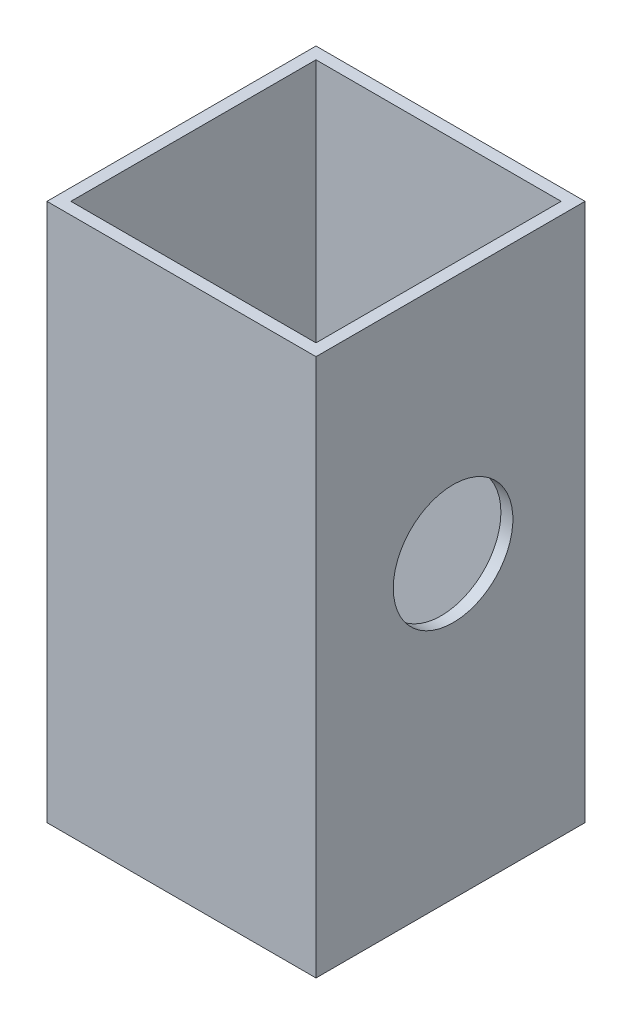
from build123d import *

# Parameters (mm, degrees)
SKETCH_1_W          = 22.5
SKETCH_1_H          = 22.5
EXTRUDE_1_DEPTH     = 45
SKETCH_2_W          = 20.5
SKETCH_2_H          = 20.5
CUT_EXTRUDE_1_DEPTH = 40
SKETCH_3_R          = 5
CUT_EXTRUDE_2_DEPTH = 40


with BuildPart() as part:
    # 草图1 → 凸台-拉伸1 (new body)
    with BuildSketch(Plane(origin=(0, 0, 0), x_dir=(1, 0, 0), z_dir=(0, 1, 0))):
        with Locations((-11.25, -11.25)):
            Rectangle(SKETCH_1_W, SKETCH_1_H)
    extrude(amount=EXTRUDE_1_DEPTH)

    # 草图2 → 切除-拉伸1 (cut)
    with BuildSketch(Plane(origin=(0, 45, 0), x_dir=(1, 0, 0), z_dir=(0, 1, 0))):
        with Locations((-11.25, -11.25)):
            Rectangle(SKETCH_2_W, SKETCH_2_H)
    extrude(amount=-CUT_EXTRUDE_1_DEPTH, mode=Mode.SUBTRACT)

    # 草图3 → 切除-拉伸2 (cut)
    with BuildSketch(Plane.ZY.offset(22.5)):
        with Locations((11.036111031, 25)):
            Circle(SKETCH_3_R)
    extrude(amount=-CUT_EXTRUDE_2_DEPTH, mode=Mode.SUBTRACT)


solid = part.part
